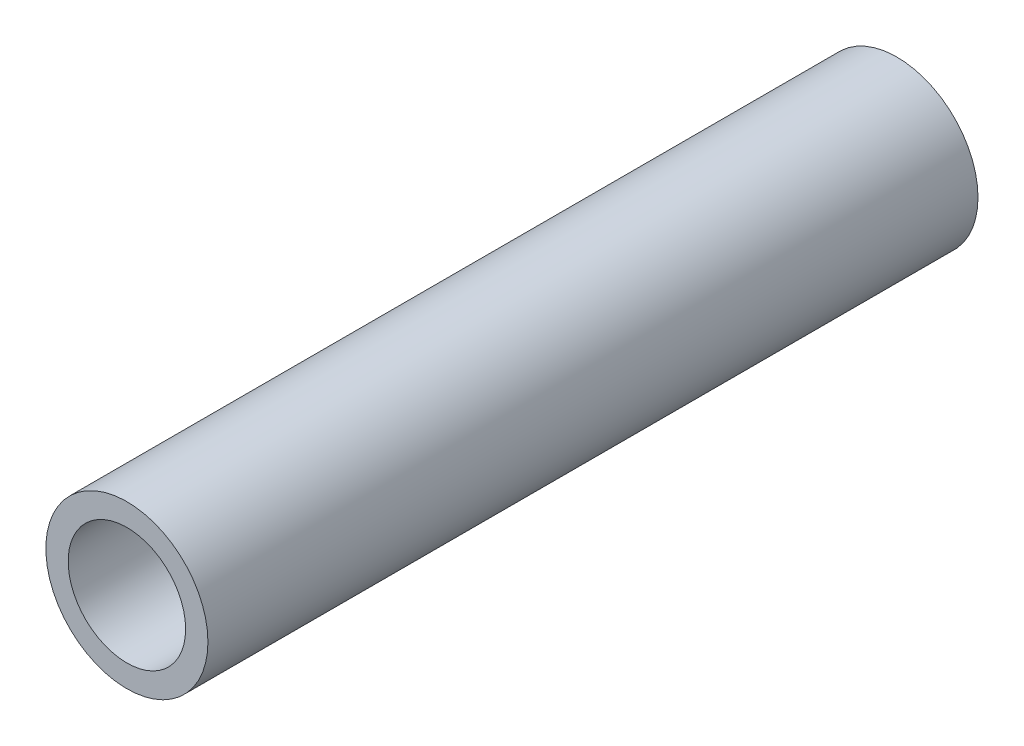
from build123d import *

# Parameters (mm, degrees)
SKETCH1_R           = 10.6934
SKETCH1_R_2         = 7.747
BOSS_EXTRUDE1_DEPTH = 101.6


with BuildPart() as part:
    # Sketch1 → Boss-Extrude1 (new body)
    with BuildSketch(Plane.XY):
        Circle(SKETCH1_R)
        Circle(SKETCH1_R_2, mode=Mode.SUBTRACT)
    extrude(amount=BOSS_EXTRUDE1_DEPTH)


solid = part.part
